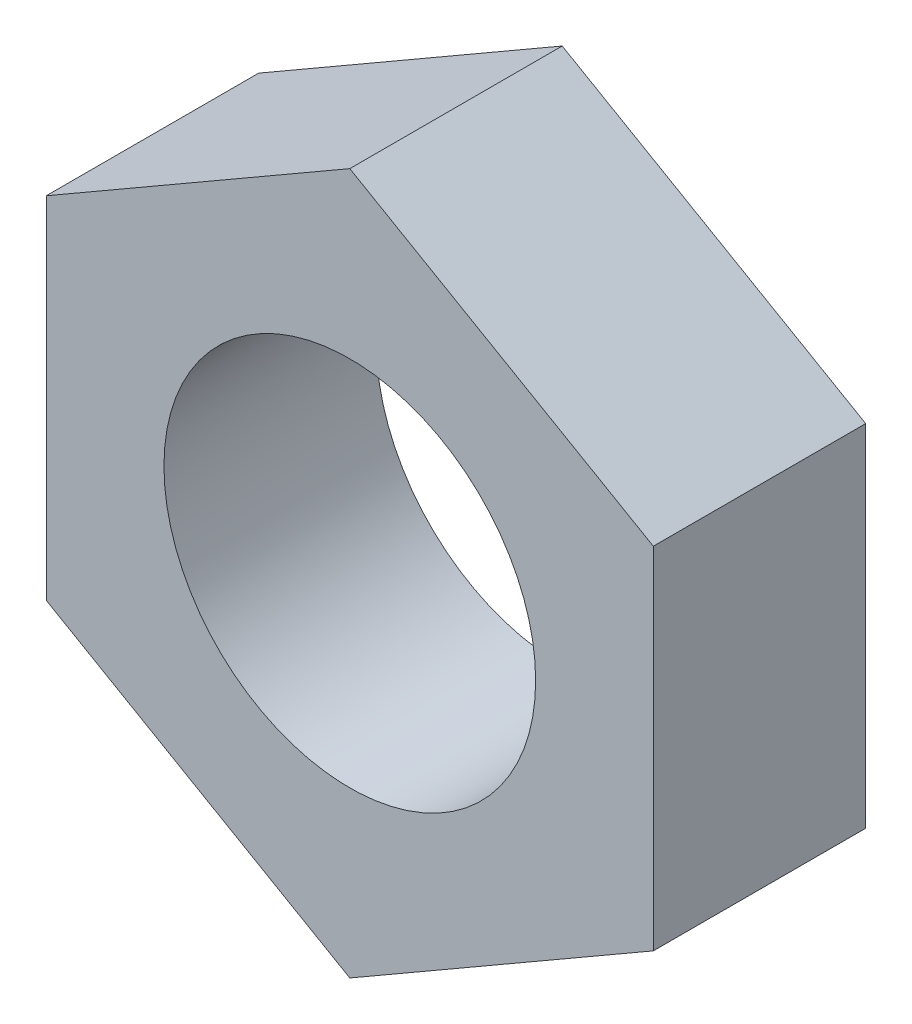
from build123d import *

# Parameters (mm, degrees)
ESQUISSE1_R        = 1.75
BOSS_EXTRU_1_DEPTH = 2


with BuildPart() as part:
    # Esquisse1 → Boss.-Extru.1 (new body)
    with BuildSketch(Plane.XY):
        Polygon((0, 3.3), (-2.857883832, 1.65), (-2.857883832, -1.65), (0, -3.3), (2.857883832, -1.65), (2.857883832, 1.65), align=None)
        Circle(ESQUISSE1_R, mode=Mode.SUBTRACT)
    extrude(amount=BOSS_EXTRU_1_DEPTH)


solid = part.part
